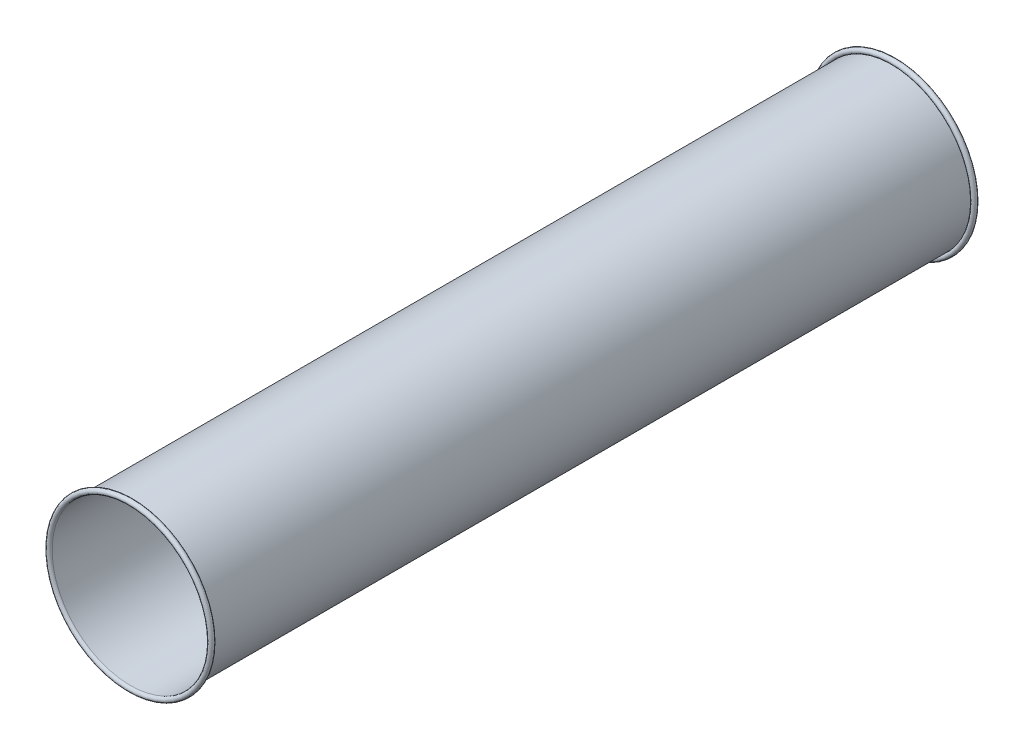
from build123d import *


with BuildPart() as part:
    # Sketch2 → Revolve1 (revolve)
    with BuildSketch(Plane(origin=(0, 0, 0), x_dir=(0, 0, -1), z_dir=(1, 0, 0)), mode=Mode.PRIVATE) as revolve1_sk:
        with BuildLine():
            Line((0, 152.95626), (-741.045, 152.95626))
            ThreePointArc((-741.045, 152.95626), (-741.769011395, 161.147263876), (-739.619428536, 153.21026))
            Line((-739.619428536, 153.21026), (-737.758299869, 153.21026))
            ThreePointArc((-737.758299869, 153.21026), (-742.795574192, 161.852605772), (-741.045, 152.00376))
            Line((-741.045, 152.00376), (0, 152.00376))
            Line((0, 152.00376), (0, 152.95626))
        make_face()
    revolve(revolve1_sk.sketch.rotate(Axis((0, 0, 746.125), (0, 0, -1)), 90), axis=Axis((0, 0, 746.125), (0, 0, -1)))

    # Mirror1: part across plane


with BuildPart() as part_1:
    add(part.part)
    add(part.part.mirror(Plane(origin=(0, 152.95626, 0), x_dir=(1, 0, 0), z_dir=(0, 0, 1))))


solid = part_1.part
